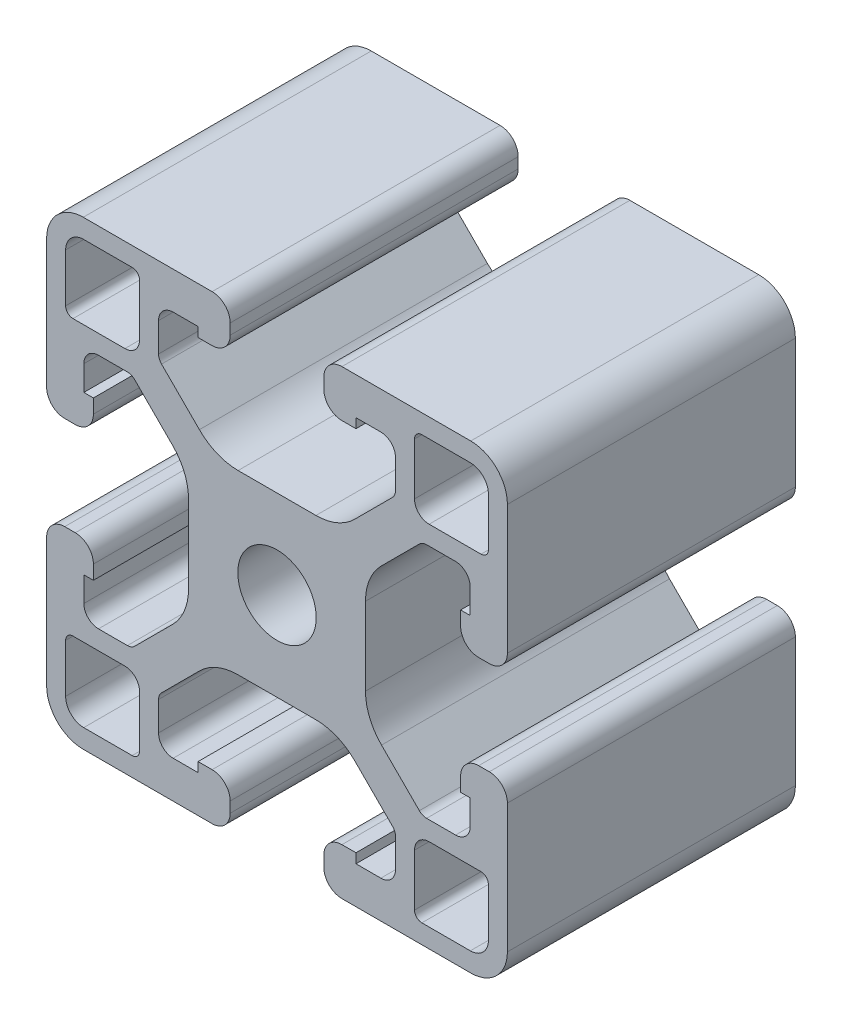
from build123d import *

# Parameters (mm, degrees)
SKETCH2_R      = 3.405
EXTRUDE1_DEPTH = 12.5


with BuildPart() as part:
    # Sketch2 → Extrude1 (new, symmetric)
    with BuildSketch(Plane.XY):
        with BuildLine():
            Line((-16.82, 20), (-5.635, 20))
            ThreePointArc((-5.635, 20), (-4.524842354, 19.540157646), (-4.065, 18.43))
            Line((-4.065, 18.43), (-4.065, 17.51))
            ThreePointArc((-4.065, 17.51), (-4.524842354, 16.399842354), (-5.635, 15.94))
            Line((-5.635, 15.94), (-6.855, 15.94))
            Line((-6.855, 15.94), (-6.855, 16.77))
            Line((-6.855, 16.77), (-9.015, 16.77))
            ThreePointArc((-9.015, 16.77), (-9.913025612, 16.398025612), (-10.285, 15.5))
            Line((-10.285, 15.5), (-10.285, 12.987102448))
            ThreePointArc((-10.285, 12.987102448), (-10.217252784, 12.646514194), (-10.024325035, 12.357777413))
            Line((-10.024325035, 12.357777413), (-6.737790411, 9.071242789))
            ThreePointArc((-6.737790411, 9.071242789), (-5.196779505, 8.041572221), (-3.379033201, 7.68))
            Line((-3.379033201, 7.68), (3.379033201, 7.68))
            ThreePointArc((3.379033201, 7.68), (5.196779505, 8.041572221), (6.737790411, 9.071242789))
            Line((6.737790411, 9.071242789), (10.024325035, 12.357777413))
            ThreePointArc((10.024325035, 12.357777413), (10.217252784, 12.646514194), (10.285, 12.987102448))
            Line((10.285, 12.987102448), (10.285, 15.5))
            ThreePointArc((10.285, 15.5), (9.913025612, 16.398025612), (9.015, 16.77))
            Line((9.015, 16.77), (6.855, 16.77))
            Line((6.855, 16.77), (6.855, 15.94))
            Line((6.855, 15.94), (5.635, 15.94))
            ThreePointArc((5.635, 15.94), (4.524842354, 16.399842354), (4.065, 17.51))
            Line((4.065, 17.51), (4.065, 18.43))
            ThreePointArc((4.065, 18.43), (4.524842354, 19.540157646), (5.635, 20))
            Line((5.635, 20), (16.82, 20))
            ThreePointArc((16.82, 20), (19.068599564, 19.068599564), (20, 16.82))
            Line((20, 16.82), (20, 5.635))
            ThreePointArc((20, 5.635), (19.540157646, 4.524842354), (18.43, 4.065))
            Line((18.43, 4.065), (17.51, 4.065))
            ThreePointArc((17.51, 4.065), (16.399842354, 4.524842354), (15.94, 5.635))
            Line((15.94, 5.635), (15.94, 6.855))
            Line((15.94, 6.855), (16.77, 6.855))
            Line((16.77, 6.855), (16.77, 9.015))
            ThreePointArc((16.77, 9.015), (16.398025612, 9.913025612), (15.5, 10.285))
            Line((15.5, 10.285), (12.987102448, 10.285))
            ThreePointArc((12.987102448, 10.285), (12.646514194, 10.217252784), (12.357777413, 10.024325035))
            Line((12.357777413, 10.024325035), (9.071242789, 6.737790411))
            ThreePointArc((9.071242789, 6.737790411), (8.041572221, 5.196779505), (7.68, 3.379033201))
            Line((7.68, 3.379033201), (7.68, -3.379033201))
            ThreePointArc((7.68, -3.379033201), (8.041572221, -5.196779505), (9.071242789, -6.737790411))
            Line((9.071242789, -6.737790411), (12.357777413, -10.024325035))
            ThreePointArc((12.357777413, -10.024325035), (12.646514194, -10.217252784), (12.987102448, -10.285))
            Line((12.987102448, -10.285), (15.5, -10.285))
            ThreePointArc((15.5, -10.285), (16.398025612, -9.913025612), (16.77, -9.015))
            Line((16.77, -9.015), (16.77, -6.855))
            Line((16.77, -6.855), (15.94, -6.855))
            Line((15.94, -6.855), (15.94, -5.635))
            ThreePointArc((15.94, -5.635), (16.399842354, -4.524842354), (17.51, -4.065))
            Line((17.51, -4.065), (18.43, -4.065))
            ThreePointArc((18.43, -4.065), (19.540157646, -4.524842354), (20, -5.635))
            Line((20, -5.635), (20, -16.82))
            ThreePointArc((20, -16.82), (19.068599564, -19.068599564), (16.82, -20))
            Line((16.82, -20), (5.635, -20))
            ThreePointArc((5.635, -20), (4.524842354, -19.540157646), (4.065, -18.43))
            Line((4.065, -18.43), (4.065, -17.51))
            ThreePointArc((4.065, -17.51), (4.524842354, -16.399842354), (5.635, -15.94))
            Line((5.635, -15.94), (6.855, -15.94))
            Line((6.855, -15.94), (6.855, -16.77))
            Line((6.855, -16.77), (9.015, -16.77))
            ThreePointArc((9.015, -16.77), (9.913025612, -16.398025612), (10.285, -15.5))
            Line((10.285, -15.5), (10.285, -12.987102448))
            ThreePointArc((10.285, -12.987102448), (10.217252784, -12.646514194), (10.024325035, -12.357777413))
            Line((10.024325035, -12.357777413), (6.737790411, -9.071242789))
            ThreePointArc((6.737790411, -9.071242789), (5.196779505, -8.041572221), (3.379033201, -7.68))
            Line((3.379033201, -7.68), (-3.379033201, -7.68))
            ThreePointArc((-3.379033201, -7.68), (-5.196779505, -8.041572221), (-6.737790411, -9.071242789))
            Line((-6.737790411, -9.071242789), (-10.024325035, -12.357777413))
            ThreePointArc((-10.024325035, -12.357777413), (-10.217252784, -12.646514194), (-10.285, -12.987102448))
            Line((-10.285, -12.987102448), (-10.285, -15.5))
            ThreePointArc((-10.285, -15.5), (-9.913025612, -16.398025612), (-9.015, -16.77))
            Line((-9.015, -16.77), (-6.855, -16.77))
            Line((-6.855, -16.77), (-6.855, -15.94))
            Line((-6.855, -15.94), (-5.635, -15.94))
            ThreePointArc((-5.635, -15.94), (-4.524842354, -16.399842354), (-4.065, -17.51))
            Line((-4.065, -17.51), (-4.065, -18.43))
            ThreePointArc((-4.065, -18.43), (-4.524842354, -19.540157646), (-5.635, -20))
            Line((-5.635, -20), (-16.82, -20))
            ThreePointArc((-16.82, -20), (-19.068599564, -19.068599564), (-20, -16.82))
            Line((-20, -16.82), (-20, -5.635))
            ThreePointArc((-20, -5.635), (-19.540157646, -4.524842354), (-18.43, -4.065))
            Line((-18.43, -4.065), (-17.51, -4.065))
            ThreePointArc((-17.51, -4.065), (-16.399842354, -4.524842354), (-15.94, -5.635))
            Line((-15.94, -5.635), (-15.94, -6.855))
            Line((-15.94, -6.855), (-16.77, -6.855))
            Line((-16.77, -6.855), (-16.77, -9.015))
            ThreePointArc((-16.77, -9.015), (-16.398025612, -9.913025612), (-15.5, -10.285))
            Line((-15.5, -10.285), (-12.987102448, -10.285))
            ThreePointArc((-12.987102448, -10.285), (-12.646514194, -10.217252784), (-12.357777413, -10.024325035))
            Line((-12.357777413, -10.024325035), (-9.071242789, -6.737790411))
            ThreePointArc((-9.071242789, -6.737790411), (-8.041572221, -5.196779505), (-7.68, -3.379033201))
            Line((-7.68, -3.379033201), (-7.68, 3.379033201))
            ThreePointArc((-7.68, 3.379033201), (-8.041572221, 5.196779505), (-9.071242789, 6.737790411))
            Line((-9.071242789, 6.737790411), (-12.357777413, 10.024325035))
            ThreePointArc((-12.357777413, 10.024325035), (-12.646514194, 10.217252784), (-12.987102448, 10.285))
            Line((-12.987102448, 10.285), (-15.5, 10.285))
            ThreePointArc((-15.5, 10.285), (-16.398025612, 9.913025612), (-16.77, 9.015))
            Line((-16.77, 9.015), (-16.77, 6.855))
            Line((-16.77, 6.855), (-15.94, 6.855))
            Line((-15.94, 6.855), (-15.94, 5.635))
            ThreePointArc((-15.94, 5.635), (-16.399842354, 4.524842354), (-17.51, 4.065))
            Line((-17.51, 4.065), (-18.43, 4.065))
            ThreePointArc((-18.43, 4.065), (-19.540157646, 4.524842354), (-20, 5.635))
            Line((-20, 5.635), (-20, 16.82))
            ThreePointArc((-20, 16.82), (-19.068599564, 19.068599564), (-16.82, 20))
        make_face()
        Circle(SKETCH2_R, mode=Mode.SUBTRACT)
        with BuildLine():
            Line((-16.78, 18.35), (-12.575, 18.35))
            ThreePointArc((-12.575, 18.35), (-12.12245166, 18.16254834), (-11.935, 17.71))
            Line((-11.935, 17.71), (-11.935, 13.205))
            ThreePointArc((-11.935, 13.205), (-12.306974388, 12.306974388), (-13.205, 11.935))
            Line((-13.205, 11.935), (-17.71, 11.935))
            ThreePointArc((-17.71, 11.935), (-18.16254834, 12.12245166), (-18.35, 12.575))
            Line((-18.35, 12.575), (-18.35, 16.78))
            ThreePointArc((-18.35, 16.78), (-17.890157646, 17.890157646), (-16.78, 18.35))
        make_face(mode=Mode.SUBTRACT)
        with BuildLine():
            Line((-18.35, -16.78), (-18.35, -12.575))
            ThreePointArc((-18.35, -12.575), (-18.16254834, -12.12245166), (-17.71, -11.935))
            Line((-17.71, -11.935), (-13.205, -11.935))
            ThreePointArc((-13.205, -11.935), (-12.306974388, -12.306974388), (-11.935, -13.205))
            Line((-11.935, -13.205), (-11.935, -17.71))
            ThreePointArc((-11.935, -17.71), (-12.12245166, -18.16254834), (-12.575, -18.35))
            Line((-12.575, -18.35), (-16.78, -18.35))
            ThreePointArc((-16.78, -18.35), (-17.890157646, -17.890157646), (-18.35, -16.78))
        make_face(mode=Mode.SUBTRACT)
        with BuildLine():
            Line((16.78, -18.35), (12.575, -18.35))
            ThreePointArc((12.575, -18.35), (12.12245166, -18.16254834), (11.935, -17.71))
            Line((11.935, -17.71), (11.935, -13.205))
            ThreePointArc((11.935, -13.205), (12.306974388, -12.306974388), (13.205, -11.935))
            Line((13.205, -11.935), (17.71, -11.935))
            ThreePointArc((17.71, -11.935), (18.16254834, -12.12245166), (18.35, -12.575))
            Line((18.35, -12.575), (18.35, -16.78))
            ThreePointArc((18.35, -16.78), (17.890157646, -17.890157646), (16.78, -18.35))
        make_face(mode=Mode.SUBTRACT)
        with BuildLine():
            Line((18.35, 16.78), (18.35, 12.575))
            ThreePointArc((18.35, 12.575), (18.16254834, 12.12245166), (17.71, 11.935))
            Line((17.71, 11.935), (13.205, 11.935))
            ThreePointArc((13.205, 11.935), (12.306974388, 12.306974388), (11.935, 13.205))
            Line((11.935, 13.205), (11.935, 17.71))
            ThreePointArc((11.935, 17.71), (12.12245166, 18.16254834), (12.575, 18.35))
            Line((12.575, 18.35), (16.78, 18.35))
            ThreePointArc((16.78, 18.35), (17.890157646, 17.890157646), (18.35, 16.78))
        make_face(mode=Mode.SUBTRACT)
    extrude(amount=EXTRUDE1_DEPTH, both=True)


solid = part.part
